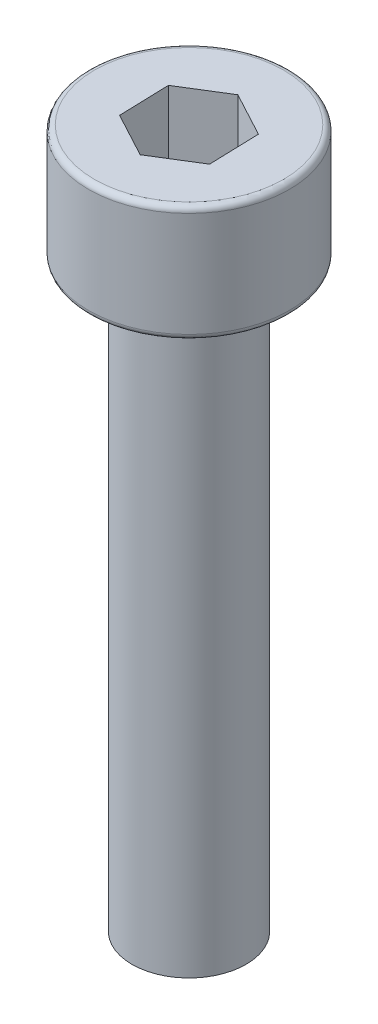
from build123d import *

# Parameters (mm, degrees)
SKETCH1_R           = 1.96
BOSS_EXTRUDE1_DEPTH = 20
SKETCH2_R           = 3.45
BOSS_EXTRUDE2_DEPTH = 4
CUT_EXTRUDE1_DEPTH  = 2.7
FILLET1_R           = 0.2


with BuildPart() as part:
    # Sketch1 → Boss-Extrude1 (new body)
    with BuildSketch(Plane(origin=(0, 0, 0), x_dir=(1, 0, 0), z_dir=(0, 1, 0))):
        with Locations(Location((0, 0, 0), (0, 0, 270))):
            Circle(SKETCH1_R)
    extrude(amount=BOSS_EXTRUDE1_DEPTH)

    # Sketch2 → Boss-Extrude2 (add)
    with BuildSketch(Plane(origin=(0, 20, 0), x_dir=(1, 0, 0), z_dir=(0, 1, 0))):
        with Locations(Location((0, 0, 0), (0, 0, 270))):
            Circle(SKETCH2_R)
    extrude(amount=BOSS_EXTRUDE2_DEPTH)

    # Sketch3 → Cut-Extrude1 (cut)
    with BuildSketch(Plane(origin=(0, 24, 0), x_dir=(1, 0, 0), z_dir=(0, 1, 0))):
        Polygon((-0.053621876, 1.731220579), (-1.526091939, 0.819172383), (-1.472470063, -0.912048197), (0.053621876, -1.731220579), (1.526091939, -0.819172383), (1.472470063, 0.912048197), align=None)
    extrude(amount=-CUT_EXTRUDE1_DEPTH, mode=Mode.SUBTRACT)

    # Fillet1
    fillet1_edges = [part.edges().sort_by_distance(p)[0] for p in [
        (0, 20, -3.45),
        (0, 24, -3.45),
    ]]
    fillet(fillet1_edges, radius=FILLET1_R)


solid = part.part
